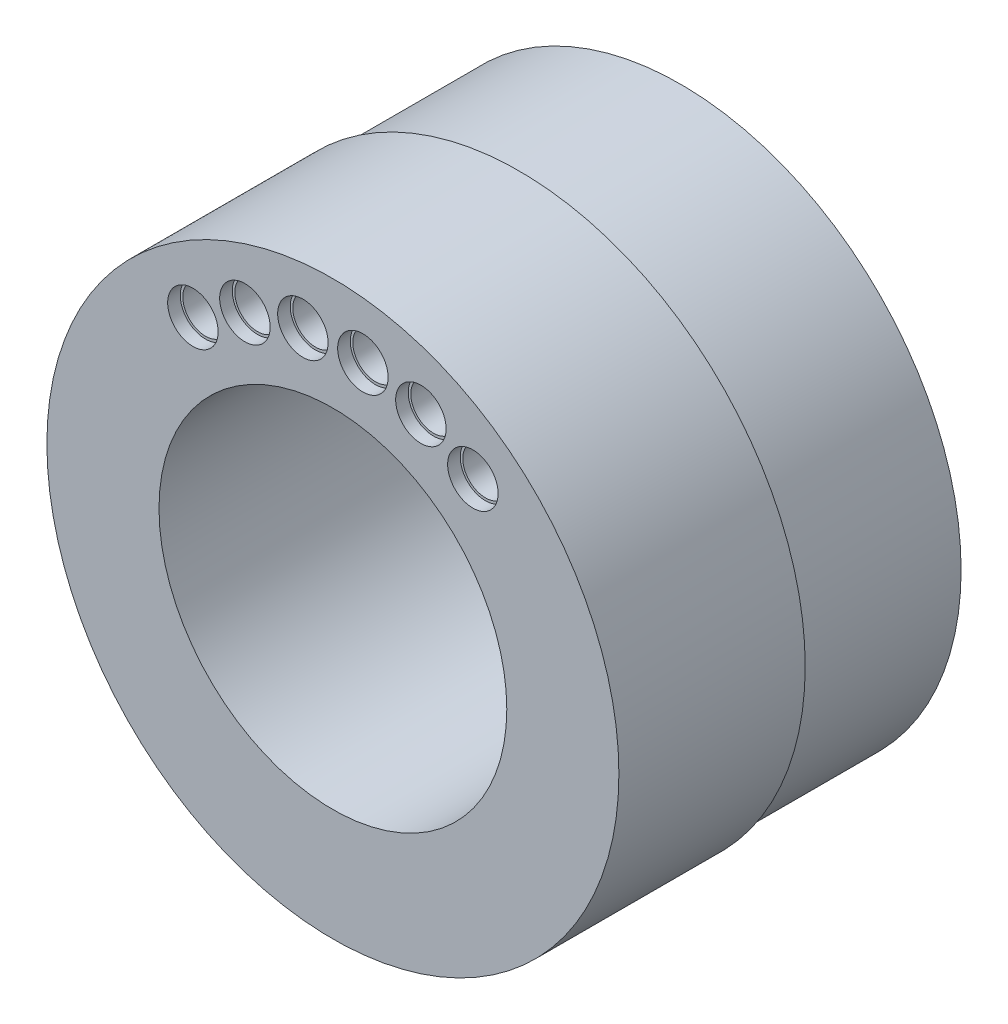
from build123d import *

# Parameters (mm, degrees)
SKETCH1_W                = 23.025
SKETCH1_H                = 15
SKETCH2_R                = 22.575
BOSS_EXTRUDE1_DEPTH      = 13
HOLE1_D                  = 20
HOLE1_CBORE_D            = 28
HOLE1_CBORE_DEPTH        = 27
M2_CLEARANCE_HOLE1_D     = 2.459
M2_CLEARANCE_HOLE1_DEPTH = 14.999999999
M2_CLEARANCE_HOLE1_TIP   = 0.738758131
SKETCH7_R                = 1.8288
CUT_EXTRUDE1_DEPTH       = 11.557
SKETCH8_R                = 2.032
CUT_EXTRUDE2_DEPTH       = 1.016


with BuildPart() as part:
    # Sketch1 → Revolve1 (revolve)
    with BuildSketch(Plane(origin=(0, 0, 0), x_dir=(1, 0, 0), z_dir=(0, 1, 0))):
        with Locations((11.5125, -20.5)):
            Rectangle(SKETCH1_W, SKETCH1_H)
    revolve(axis=Axis((0, 0, 13), (0, 0, 1)))

    # Sketch2 → Boss-Extrude1 (add)
    with BuildSketch(Plane(origin=(0, 0, 13), x_dir=(-1, 0, 0), z_dir=(0, 0, -1))):
        with Locations(Location((0, 0, 0), (0, 0, 180))):
            Circle(SKETCH2_R)
    extrude(amount=BOSS_EXTRUDE1_DEPTH)

    # Hole1 (through all)
    with Locations(Plane.XY.offset(28)):
        with Locations((0, 0)):
            CounterBoreHole(HOLE1_D / 2, HOLE1_CBORE_D / 2, HOLE1_CBORE_DEPTH)

    # M2 Clearance Hole1
    with Locations(Plane(origin=(0, 0, 0), x_dir=(-1, 0, 0), z_dir=(0, 0, -1))):
        with Locations((0, 17.5), (-17.5, 0), (0, -17.5), (17.5, 0)):
            Hole(M2_CLEARANCE_HOLE1_D / 2, depth=M2_CLEARANCE_HOLE1_DEPTH)
            with Locations((0, 0, -(M2_CLEARANCE_HOLE1_DEPTH + M2_CLEARANCE_HOLE1_TIP / 2))):  # 118° drill point
                Cone(0, M2_CLEARANCE_HOLE1_D / 2, M2_CLEARANCE_HOLE1_TIP, mode=Mode.SUBTRACT)

    # Sketch7 → Cut-Extrude1 (cut)
    with BuildSketch(Plane.XY.offset(28)):
        with Locations((-2.416366133, 18.354122996)):
            Circle(SKETCH7_R)
        with Locations((-7.084427042, 17.103319846)):
            Circle(SKETCH7_R)
        with Locations((-11.269695955, 14.686953712)):
            Circle(SKETCH7_R)
        with Locations(Location((11.269695955, 14.686953712, 0), (0, 0, 180))):
            Circle(SKETCH7_R)
        with Locations(Location((7.084427042, 17.103319846, 0), (0, 0, 180))):
            Circle(SKETCH7_R)
        with Locations(Location((2.416366133, 18.354122996, 0), (0, 0, 180))):
            Circle(SKETCH7_R)
    extrude(amount=-CUT_EXTRUDE1_DEPTH, mode=Mode.SUBTRACT)

    # Sketch8 → Cut-Extrude2 (cut)
    with BuildSketch(Plane.XY.offset(28)):
        with Locations((-11.269695955, 14.686953712)):
            Circle(SKETCH8_R)
        with Locations((-7.084427042, 17.103319846)):
            Circle(SKETCH8_R)
        with Locations((-2.416366133, 18.354122996)):
            Circle(SKETCH8_R)
        with Locations((2.416366133, 18.354122996)):
            Circle(SKETCH8_R)
        with Locations((7.084427042, 17.103319846)):
            Circle(SKETCH8_R)
        with Locations((11.269695955, 14.686953712)):
            Circle(SKETCH8_R)
    extrude(amount=-CUT_EXTRUDE2_DEPTH, mode=Mode.SUBTRACT)


solid = part.part
